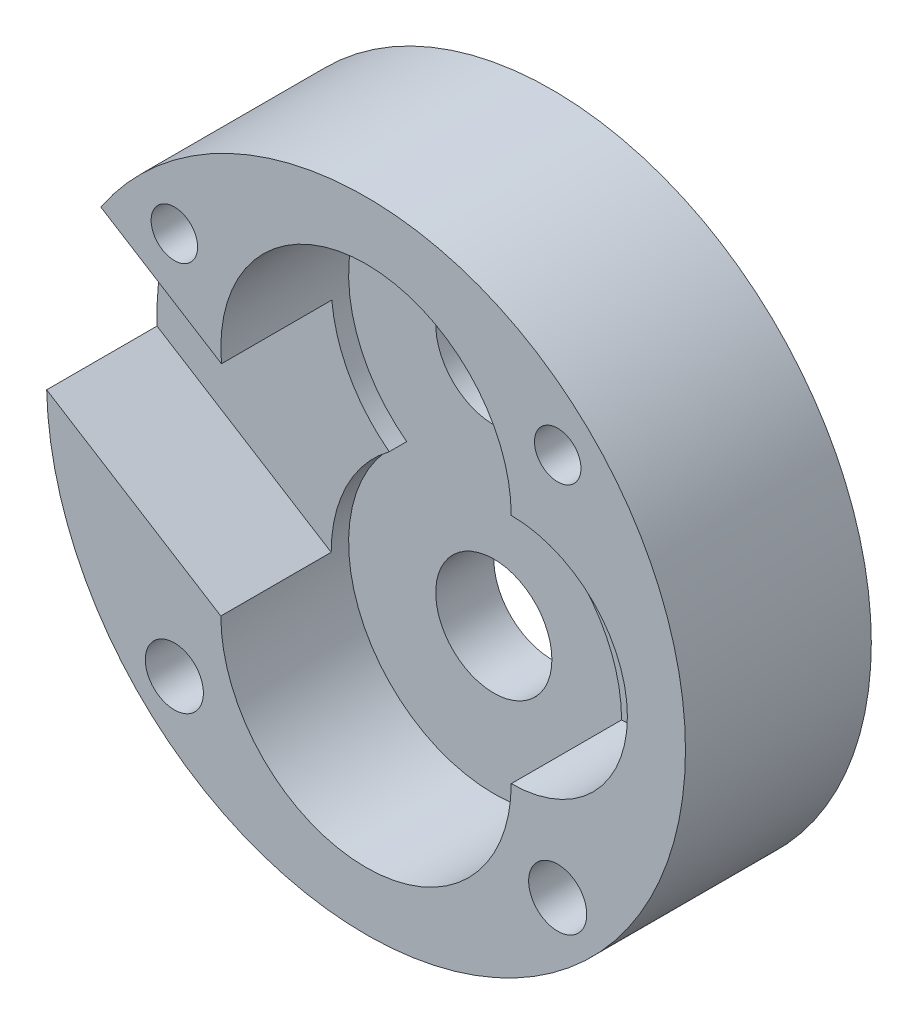
from build123d import *

# Parameters (mm, degrees)
SKETCH1_R           = 55
BOSS_EXTRUDE1_DEPTH = 32
SKETCH1_19_R        = 10
CUT_EXTRUDE1_DEPTH  = 22
CUT_EXTRUDE2_DEPTH  = 19
SKETCH1_21_R        = 10
SKETCH1_21_R_2      = 4
SKETCH1_21_R_3      = 5
CUT_EXTRUDE3_DEPTH  = 85.107074613


with BuildPart() as part:
    # Sketch1 → Boss-Extrude1 (new body)
    with BuildSketch(Plane.XY):
        Circle(SKETCH1_R)
    extrude(amount=-BOSS_EXTRUDE1_DEPTH)

    # Sketch1<19> → Cut-Extrude1 (cut)
    # profile 1 of 3: a face of its own
    with BuildSketch(Plane.XY):
        with BuildLine():
            ThreePointArc((15, 0), (0, 45), (-15, 0))
            ThreePointArc((-15, 0), (0, -45), (15, 0))
        make_face()
        with Locations((0, -20)):
            Circle(SKETCH1_19_R, mode=Mode.SUBTRACT)
        with Locations((0, 20)):
            Circle(SKETCH1_19_R, mode=Mode.SUBTRACT)
    # profile 2 of 3: a face of its own
    with BuildSketch(Plane.XY):
        with Locations((0, -20)):
            Circle(SKETCH1_19_R)
    # profile 3 of 3: a face of its own
    with BuildSketch(Plane.XY):
        with Locations((0, 20)):
            Circle(SKETCH1_19_R)
    extrude(amount=-CUT_EXTRUDE1_DEPTH, mode=Mode.SUBTRACT)

    # Sketch1<20> → Cut-Extrude2 (cut)
    with BuildSketch(Plane.XY):
        with BuildLine():
            ThreePointArc((-45.668792135, 30.649003654), (-52.795976975, 15.41378653), (-54.985496966, -1.262981944))
            Line((-54.985496966, -1.262981944), (-25, -20))
            ThreePointArc((-25, -20), (-22.360679775, -8.819660113), (-15, 0))
            ThreePointArc((-15, 0), (-21.813646246, 7.786694246), (-24.890758601, 17.665447305))
            Line((-24.890758601, 17.665447305), (-45.668792135, 30.649003654))
        make_face()
        with BuildLine():
            ThreePointArc((15, 0), (22.360679775, -8.819660113), (25, -20))
            ThreePointArc((25, -20), (45, 0), (25, 20))
            ThreePointArc((25, 20), (22.360679775, 8.819660113), (15, 0))
        make_face()
    extrude(amount=-CUT_EXTRUDE2_DEPTH, mode=Mode.SUBTRACT)

    # Sketch1<21> → Cut-Extrude3 (cut, through all)
    with BuildSketch(Plane.XY):
        with Locations((0, 20)):
            Circle(SKETCH1_21_R)
        with Locations((0, -20)):
            Circle(SKETCH1_21_R)
        with Locations((-33, 33)):
            Circle(SKETCH1_21_R_2)
        with Locations((33, 33)):
            Circle(SKETCH1_21_R_2)
        with Locations((33, -33)):
            Circle(SKETCH1_21_R_3)
        with Locations((-33, -33)):
            Circle(SKETCH1_21_R_3)
    extrude(amount=-CUT_EXTRUDE3_DEPTH, mode=Mode.SUBTRACT)


solid = part.part
